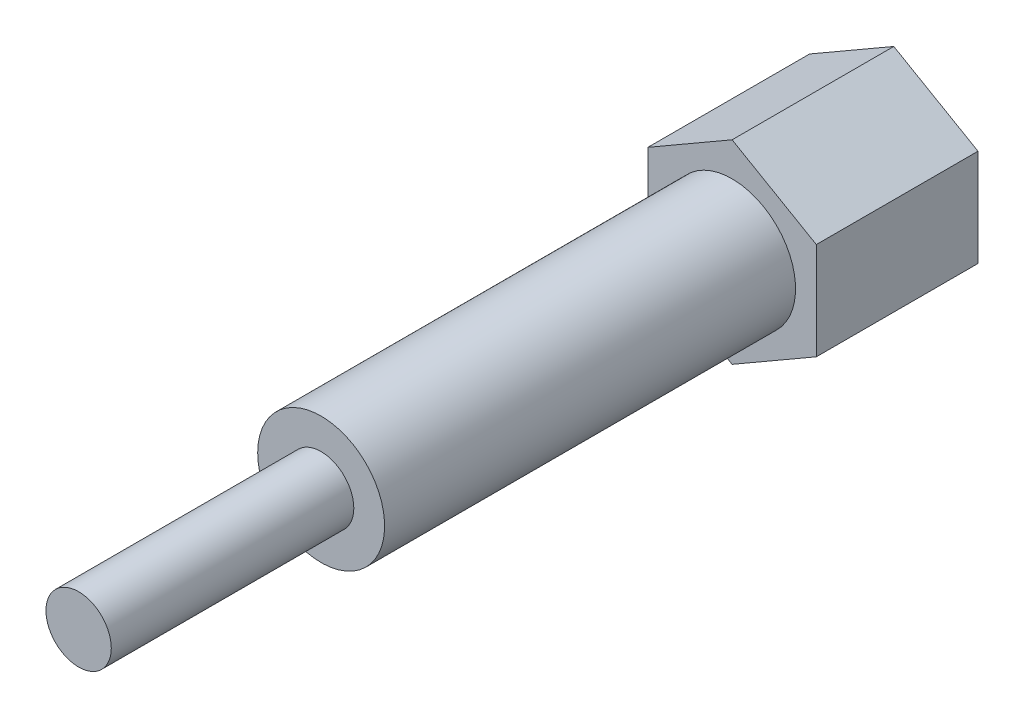
from build123d import *

# Parameters (mm, degrees)
SALIENTE_EXTRUIR1_DEPTH = 12
CROQUIS2_R              = 4.71
SALIENTE_EXTRUIR2_DEPTH = 30.5
CROQUIS3_R              = 2.425
SALIENTE_EXTRUIR3_DEPTH = 18


with BuildPart() as part:
    # Croquis1 → Saliente-Extruir1 (new body)
    with BuildSketch(Plane.XY):
        Polygon((0, 7.216878365), (-6.25, 3.608439182), (-6.25, -3.608439182), (0, -7.216878365), (6.25, -3.608439182), (6.25, 3.608439182), align=None)
    extrude(amount=SALIENTE_EXTRUIR1_DEPTH)

    # Croquis2 → Saliente-Extruir2 (add)
    with BuildSketch(Plane.XY.offset(12)):
        with Locations(Location((0, 0, 0), (0, 0, 180))):
            Circle(CROQUIS2_R)
    extrude(amount=SALIENTE_EXTRUIR2_DEPTH)

    # Croquis3 → Saliente-Extruir3 (add)
    with BuildSketch(Plane.XY.offset(42.5)):
        Circle(CROQUIS3_R)
    extrude(amount=SALIENTE_EXTRUIR3_DEPTH)


solid = part.part
